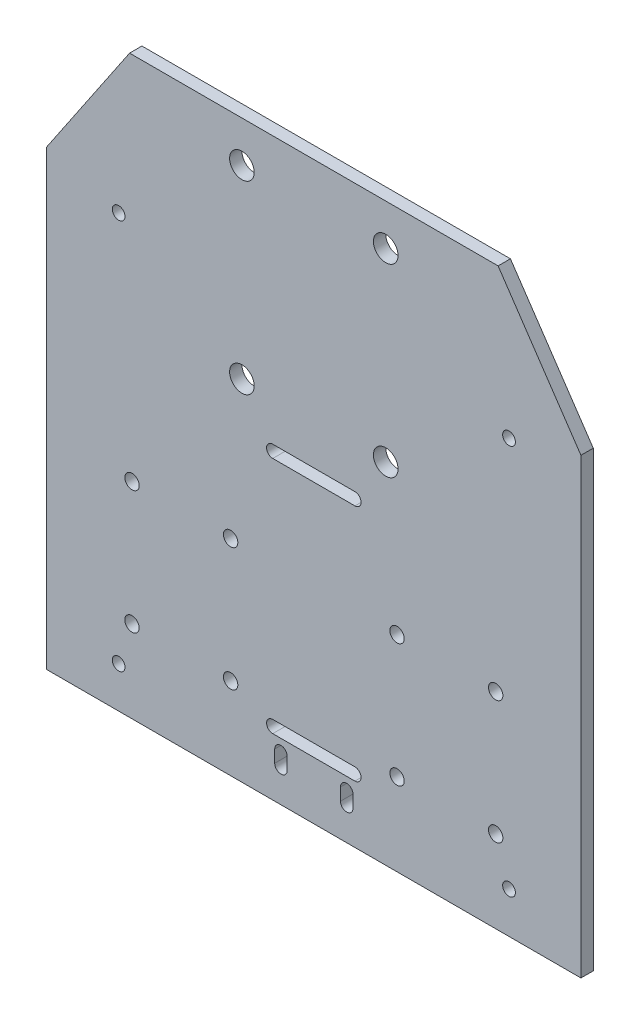
from build123d import *

# Parameters (mm, degrees)
SKETCH_1_R          = 1.75
SKETCH_1_R_2        = 3
EXTRUDE_1_DEPTH     = 3
CUT_EXTRUDE_2_DEPTH = 10
SKETCH_5_R          = 1.55
CUT_EXTRUDE_3_DEPTH = 10


with BuildPart() as part:
    # 草图1 → 凸台-拉伸1 (new body)
    with BuildSketch(Plane.XY):
        Polygon((65, -25), (65, 75.163369284), (44.840227583, 105), (-44.840227583, 105), (-65, 75.163369284), (-65, -25), (-65, -35), (65, -35), align=None)
        with Locations((44.25, -15)):
            Circle(SKETCH_1_R, mode=Mode.SUBTRACT)
        with Locations((20.25, -15)):
            Circle(SKETCH_1_R, mode=Mode.SUBTRACT)
        with Locations((20.25, 15)):
            Circle(SKETCH_1_R, mode=Mode.SUBTRACT)
        with Locations((44.25, 15)):
            Circle(SKETCH_1_R, mode=Mode.SUBTRACT)
        with Locations(Location((-44.25, 15, 0), (0, 0, 180))):
            Circle(SKETCH_1_R, mode=Mode.SUBTRACT)
        with Locations(Location((-20.25, 15, 0), (0, 0, 180))):
            Circle(SKETCH_1_R, mode=Mode.SUBTRACT)
        with Locations(Location((-20.25, -15, 0), (0, 0, 180))):
            Circle(SKETCH_1_R, mode=Mode.SUBTRACT)
        with Locations(Location((-44.25, -15, 0), (0, 0, 180))):
            Circle(SKETCH_1_R, mode=Mode.SUBTRACT)
        with Locations((-17.5, 95)):
            Circle(SKETCH_1_R_2, mode=Mode.SUBTRACT)
        with Locations(Location((17.5, 95, 0), (0, 0, 180))):
            Circle(SKETCH_1_R_2, mode=Mode.SUBTRACT)
        with Locations((-17.5, 50)):
            Circle(SKETCH_1_R_2, mode=Mode.SUBTRACT)
        with Locations(Location((17.5, 50, 0), (0, 0, 180))):
            Circle(SKETCH_1_R_2, mode=Mode.SUBTRACT)
        with BuildLine():
            Line((-10, 40), (10, 40))
            ThreePointArc((10, 40), (11.5, 38.5), (10, 37))
            Line((10, 37), (-10, 37))
            ThreePointArc((-10, 37), (-11.5, 38.5), (-10, 40))
        make_face(mode=Mode.SUBTRACT)
        with BuildLine():
            Line((-10, -18), (10, -18))
            ThreePointArc((10, -18), (11.5, -19.5), (10, -21))
            Line((10, -21), (-10, -21))
            ThreePointArc((-10, -21), (-11.5, -19.5), (-10, -18))
        make_face(mode=Mode.SUBTRACT)
    extrude(amount=EXTRUDE_1_DEPTH)

    # 草图3 → 切除-拉伸2 (cut)
    with BuildSketch(Plane(origin=(0, 0, 0), x_dir=(-1, 0, 0), z_dir=(0, 0, -1))):
        with BuildLine():
            Line((-9.52, -27), (-9.52, -24))
            ThreePointArc((-9.52, -24), (-8, -22.48), (-6.48, -24))
            Line((-6.48, -24), (-6.48, -27))
            ThreePointArc((-6.48, -27), (-8, -28.52), (-9.52, -27))
        make_face()
        with BuildLine():
            Line((9.52, -27), (9.52, -24))
            ThreePointArc((9.52, -24), (8, -22.48), (6.48, -24))
            Line((6.48, -24), (6.48, -27))
            ThreePointArc((6.48, -27), (8, -28.52), (9.52, -27))
        make_face()
    extrude(amount=-CUT_EXTRUDE_2_DEPTH, mode=Mode.SUBTRACT)

    # 草图5 → 切除-拉伸3 (cut)
    with BuildSketch(Plane.XY.offset(3)):
        with Locations((-47.5, 70)):
            Circle(SKETCH_5_R)
        with Locations((47.5, 70)):
            Circle(SKETCH_5_R)
        with Locations((-47.5, -25)):
            Circle(SKETCH_5_R)
        with Locations((47.5, -25)):
            Circle(SKETCH_5_R)
    extrude(amount=-CUT_EXTRUDE_3_DEPTH, mode=Mode.SUBTRACT)


solid = part.part
